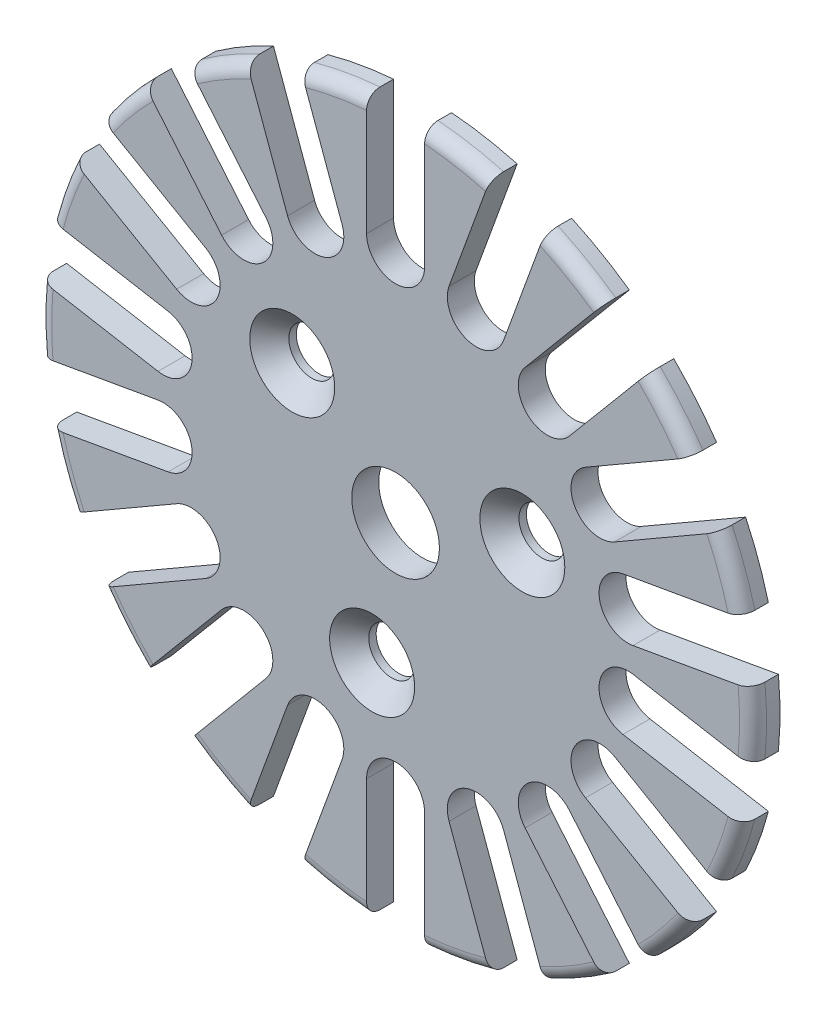
from build123d import *

# Parameters (mm, degrees)
SKETCH1_R                                       = 26.5
SKETCH1_R_2                                     = 3.25
EXTRUDE1_DEPTH                                  = 2
EXTRUDE2_DEPTH                                  = 2
CIRPATTERN1_COUNT                               = 18
SKETCH3_R                                       = 1.5
EXTRUDE3_DEPTH                                  = 2
CIRPATTERN2_COUNT                               = 3
FILLET1_R                                       = 1
CSK_FOR_M3_FLAT_HEAD_MACHINE_SCREW1_D           = 3.4
CSK_FOR_M3_FLAT_HEAD_MACHINE_SCREW1_DEPTH       = 15
CSK_FOR_M3_FLAT_HEAD_MACHINE_SCREW1_CSINK_D     = 6.3
CSK_FOR_M3_FLAT_HEAD_MACHINE_SCREW1_CSINK_ANGLE = 90
CSK_FOR_M3_FLAT_HEAD_MACHINE_SCREW1_TIP         = 1.021463052


with BuildPart() as part:
    # Sketch1 → Extrude1 (new body)
    with BuildSketch(Plane.XY):
        Circle(SKETCH1_R)
        Circle(SKETCH1_R_2, mode=Mode.SUBTRACT)
    extrude(amount=EXTRUDE1_DEPTH)

    # Sketch2 → Extrude2 (cut)
    with BuildSketch(Plane.XY.offset(2)):
        with BuildLine():
            Line((2.15, 30.5), (2.15, 17.5))
            ThreePointArc((2.15, 17.5), (0, 15.35), (-2.15, 17.5))
            Line((-2.15, 17.5), (-2.15, 30.5))
            Line((-2.15, 30.5), (2.15, 30.5))
        make_face()
    extrude2 = extrude(amount=-EXTRUDE2_DEPTH, mode=Mode.SUBTRACT)

    # CirPattern1: Extrude2 ×18 about axis
    cirpattern1_axis = Axis((0, 0, 0), (0, 0, 1))
    for i in range(1, CIRPATTERN1_COUNT):
        add(extrude2.rotate(cirpattern1_axis, i * 360 / CIRPATTERN1_COUNT), mode=Mode.SUBTRACT)

    # Sketch3 → Extrude3 (cut)
    with BuildSketch(Plane.XY.offset(2)):
        with Locations((-1.736481777, -9.84807753)):
            Circle(SKETCH3_R)
    extrude3 = extrude(amount=-EXTRUDE3_DEPTH, mode=Mode.SUBTRACT)

    # CirPattern2: Extrude3 ×3 about axis
    cirpattern2_axis = Axis((0, 0, 0), (0, 0, 1))
    for i in range(1, CIRPATTERN2_COUNT):
        add(extrude3.rotate(cirpattern2_axis, i * 360 / CIRPATTERN2_COUNT), mode=Mode.SUBTRACT)

    # Fillet1
    fillet1_edges = [part.edges().sort_by_distance(p)[0] for p in [
        (-20.300177743, -17.033871657, 2),
        (-13.25, -22.9496732, 2),
        (-4.601676708, -26.097405455, 2),
        (4.601676708, -26.097405455, 2),
        (13.25, -22.9496732, 2),
        (20.300177743, -17.033871657, 2),
        (24.901854451, -9.063533798, 2),
        (26.5, 0, 2),
        (24.901854451, 9.063533798, 2),
        (20.300177743, 17.033871657, 2),
        (-13.25, 22.9496732, 2),
        (13.25, 22.9496732, 2),
        (4.601676708, 26.097405455, 2),
        (-20.300177743, 17.033871657, 2),
        (-24.901854451, 9.063533798, 2),
        (-26.5, 0, 2),
        (-24.901854451, -9.063533798, 2),
        (-4.601676708, 26.097405455, 2),
    ]]
    fillet(fillet1_edges, radius=FILLET1_R)

    # CSK for M3 Flat Head Machine Screw1
    with Locations(Plane.XY.offset(2)):
        with Locations((-7.660444431, 6.427876097), (9.396926208, 3.420201433), (-1.736481777, -9.84807753)):
            CounterSinkHole(CSK_FOR_M3_FLAT_HEAD_MACHINE_SCREW1_D / 2, CSK_FOR_M3_FLAT_HEAD_MACHINE_SCREW1_CSINK_D / 2, depth=CSK_FOR_M3_FLAT_HEAD_MACHINE_SCREW1_DEPTH, counter_sink_angle=CSK_FOR_M3_FLAT_HEAD_MACHINE_SCREW1_CSINK_ANGLE)
            with Locations((0, 0, -(CSK_FOR_M3_FLAT_HEAD_MACHINE_SCREW1_DEPTH + CSK_FOR_M3_FLAT_HEAD_MACHINE_SCREW1_TIP / 2))):  # 118° drill point
                Cone(0, CSK_FOR_M3_FLAT_HEAD_MACHINE_SCREW1_D / 2, CSK_FOR_M3_FLAT_HEAD_MACHINE_SCREW1_TIP, mode=Mode.SUBTRACT)


solid = part.part
